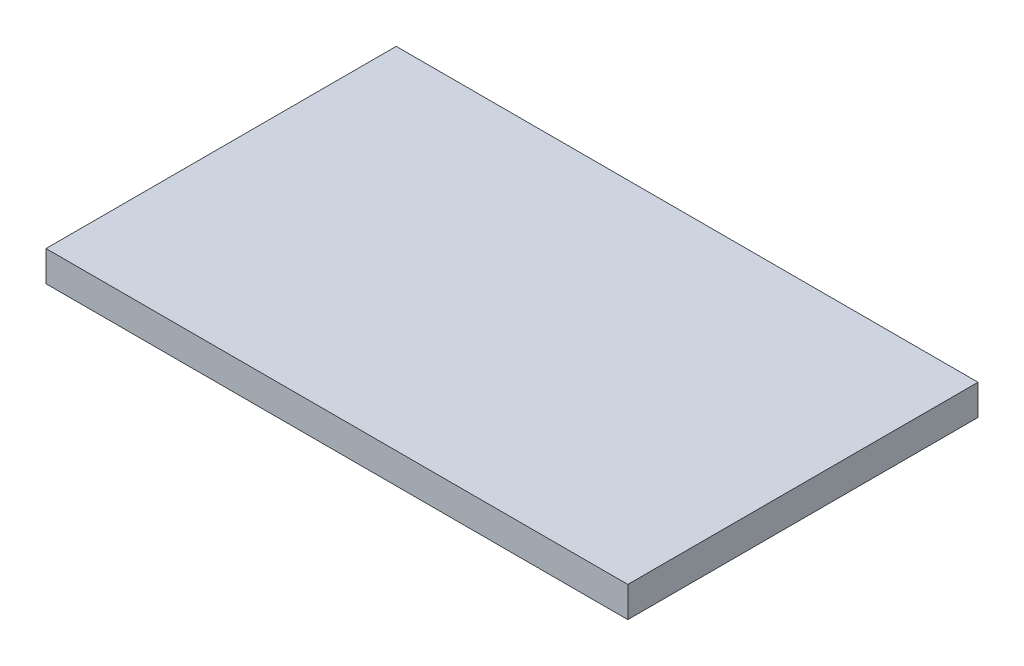
from build123d import *

# Parameters (mm, degrees)
SKETCH1_W           = 190.652441846
SKETCH1_H           = 114.756599744
BOSS_EXTRUDE1_DEPTH = 10


with BuildPart() as part:
    # Sketch1 → Boss-Extrude1 (new body)
    with BuildSketch(Plane(origin=(0, 0, 0), x_dir=(1, 0, 0), z_dir=(0, 1, 0))):
        Rectangle(SKETCH1_W, SKETCH1_H)
    extrude(amount=BOSS_EXTRUDE1_DEPTH)


solid = part.part
